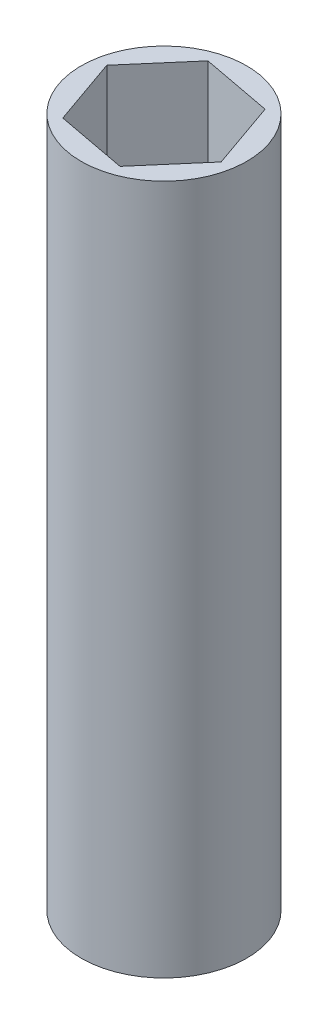
from build123d import *

# Parameters (mm, degrees)
SKETCH_1_R          = 30
EXTRUDE_1_DEPTH     = 250
CUT_EXTRUDE_1_DEPTH = 254.574446662


with BuildPart() as part:
    # 草图1 → 凸台-拉伸1 (new body)
    with BuildSketch(Plane(origin=(0, 0, 0), x_dir=(1, 0, 0), z_dir=(0, 1, 0))):
        with Locations(Location((0, 0, 0), (0, 0, 270))):
            Circle(SKETCH_1_R)
    extrude(amount=EXTRUDE_1_DEPTH)

    # 草图3 → 切除-拉伸1 (cut, through all)
    with BuildSketch(Plane(origin=(0, 250, 0), x_dir=(1, 0, 0), z_dir=(0, 1, 0))):
        Polygon((25.531400595, -4.811193579), (16.93231616, 19.70524472), (-8.599084435, 24.516438299), (-25.531400595, 4.811193579), (-16.93231616, -19.70524472), (8.599084435, -24.516438299), align=None)
    extrude(amount=-CUT_EXTRUDE_1_DEPTH, mode=Mode.SUBTRACT)


solid = part.part
